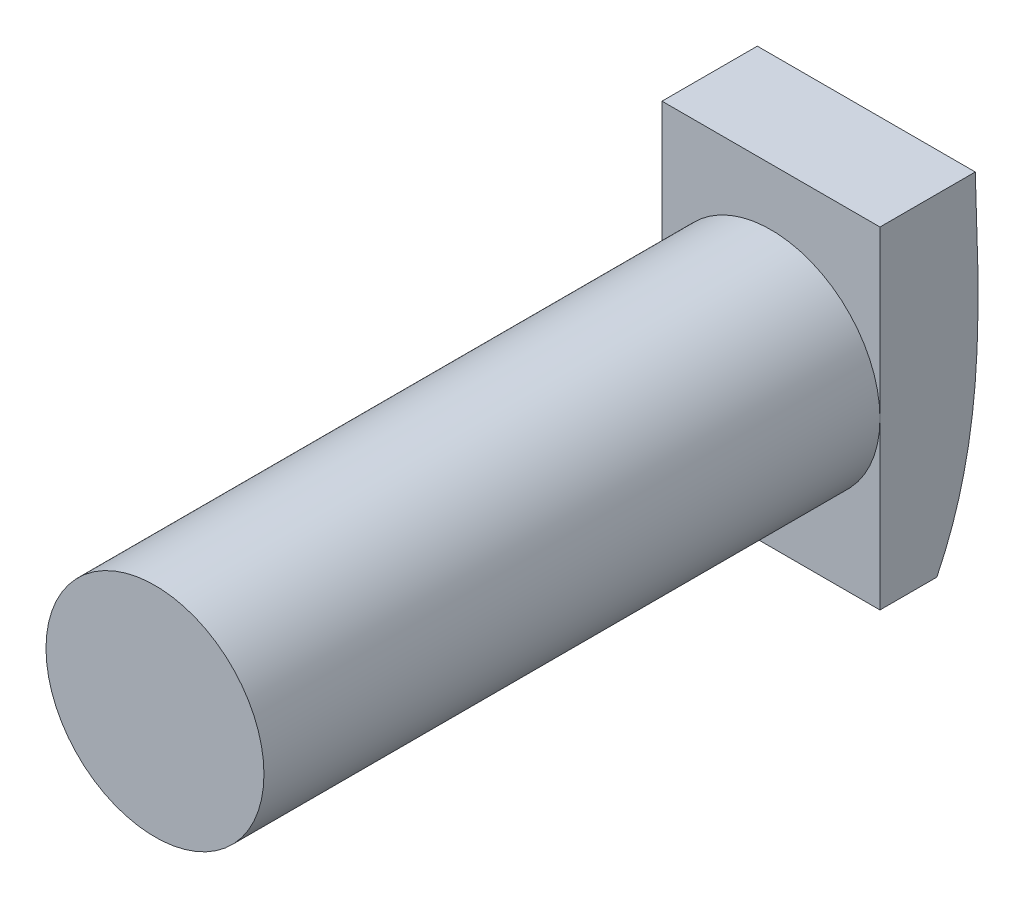
from build123d import *

# Parameters (mm, degrees)
SKETCH1_R           = 2.3
BOSS_EXTRUDE1_DEPTH = 13
SKETCH2_W           = 4.6
SKETCH2_H           = 7
BOSS_EXTRUDE2_DEPTH = 3
CUT_EXTRUDE1_DEPTH  = 4.6


with BuildPart() as part:
    # Sketch1 → Boss-Extrude1 (new body)
    with BuildSketch(Plane.XY):
        with Locations(Location((0, 0, 0), (0, 0, 180))):
            Circle(SKETCH1_R)
    extrude(amount=BOSS_EXTRUDE1_DEPTH)

    # Sketch2 → Boss-Extrude2 (add)
    with BuildSketch(Plane(origin=(0, 0, 0), x_dir=(-1, 0, 0), z_dir=(0, 0, -1))):
        Rectangle(SKETCH2_W, SKETCH2_H)
    extrude(amount=BOSS_EXTRUDE2_DEPTH)

    # Sketch3 → Cut-Extrude1 (cut)
    with BuildSketch(Plane(origin=(2.3, 0, 0), x_dir=(0, 0, -1), z_dir=(1, 0, 0))):
        with BuildLine():
            Line((1.2, -3.5), (3, -3.5))
            Line((3, -3.5), (3, 3.5))
            Line((3, 3.5), (2.011534301, 3.5))
            add(Edge.make_bspline(
                [(1.2, -3.5), (2.267514736, -1.334400874), (2.08240034, 1.182388913), (2.011534301, 3.5)],
                knots=[0, 0, 0, 0, 1, 1, 1, 1], degree=3))
        make_face()
    extrude(amount=-CUT_EXTRUDE1_DEPTH, mode=Mode.SUBTRACT)


solid = part.part
